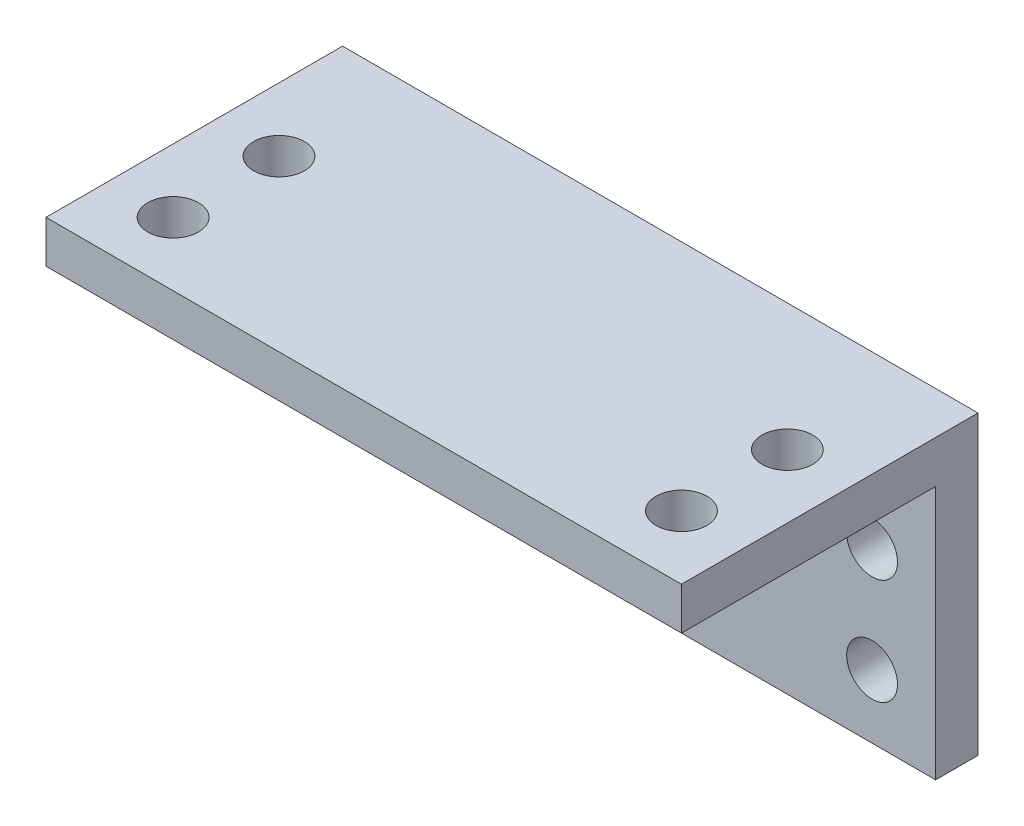
from build123d import *

# Parameters (mm, degrees)
BOSS_EXTRUDE1_DEPTH = 38.1
SKETCH2_R           = 1.524
CUT_EXTRUDE1_DEPTH  = 57.149295064
SKETCH3_R           = 1.524
CUT_EXTRUDE2_DEPTH  = 45.844943949


with BuildPart() as part:
    # Sketch1 → Boss-Extrude1 (new body)
    with BuildSketch(Plane(origin=(0, 0, 0), x_dir=(0, 0, -1), z_dir=(1, 0, 0))):
        Polygon((-2.180942408, -19.43565445), (15.599057592, -19.43565445), (15.599057592, -37.21565445), (13.059057592, -37.21565445), (13.059057592, -21.97565445), (-2.180942408, -21.97565445), align=None)
    extrude(amount=BOSS_EXTRUDE1_DEPTH)

    # Sketch2 → Cut-Extrude1 (cut, through all)
    with BuildSketch(Plane(origin=(0, 0, -15.599057592), x_dir=(-1, 0, 0), z_dir=(0, 0, -1))):
        with Locations(Location((-34.29, -33.40565445, 0), (0, 0, 90))):
            Circle(SKETCH2_R)
        with Locations(Location((-3.81, -33.40565445, 0), (0, 0, 90))):
            Circle(SKETCH2_R)
        with Locations(Location((-3.81, -27.05565445, 0), (0, 0, 90))):
            Circle(SKETCH2_R)
        with Locations(Location((-34.29, -27.05565445, 0), (0, 0, 90))):
            Circle(SKETCH2_R)
    extrude(amount=-CUT_EXTRUDE1_DEPTH, mode=Mode.SUBTRACT)

    # Sketch3 → Cut-Extrude2 (cut, through all)
    with BuildSketch(Plane(origin=(0, -19.43565445, 0), x_dir=(1, 0, 0), z_dir=(0, 1, 0))):
        with Locations(Location((3.81, 1.629057592, 0), (0, 0, 270))):
            Circle(SKETCH3_R)
        with Locations(Location((34.29, 1.629057592, 0), (0, 0, 270))):
            Circle(SKETCH3_R)
        with Locations(Location((3.81, 7.979057592, 0), (0, 0, 270))):
            Circle(SKETCH3_R)
        with Locations(Location((34.29, 7.979057592, 0), (0, 0, 270))):
            Circle(SKETCH3_R)
    extrude(amount=-CUT_EXTRUDE2_DEPTH, mode=Mode.SUBTRACT)


solid = part.part
